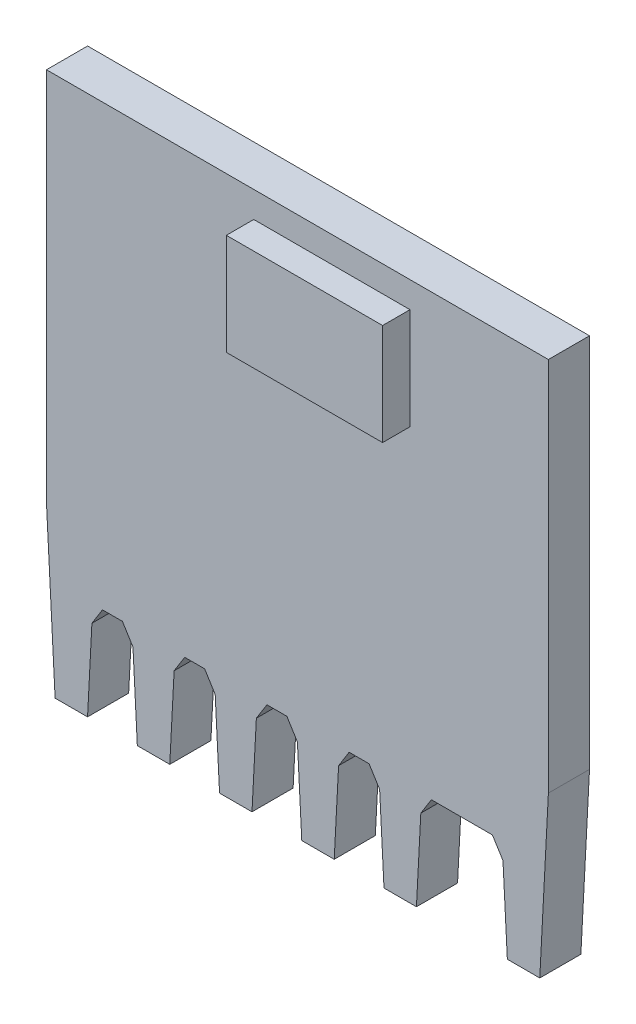
from build123d import *

# Parameters (mm, degrees)
BOSS_EXTRUDE1_DEPTH = 1.5
RGB_LED_W           = 5.7
RGB_LED_H           = 3.7
BOSS_EXTRUDE2_DEPTH = 1


with BuildPart() as part:
    # Sketch1 → Boss-Extrude1 (new body)
    with BuildSketch(Plane.XY):
        Polygon((0, 6), (0.314446676, 0), (1.497941481, 0), (1.657221927, 3.039251967), (2.042586863, 3.65596478), (2.769801294, 3.65596478), (3.155166229, 3.039251967), (3.314446676, 0), (4.497941481, 0), (4.657221927, 3.039251967), (5.042586863, 3.65596478), (5.769801294, 3.65596478), (6.155166229, 3.039251967), (6.314446676, 0), (7.497941481, 0), (7.657221927, 3.039251967), (8.042586863, 3.65596478), (8.769801294, 3.65596478), (9.155166229, 3.039251967), (9.314446676, 0), (10.497941481, 0), (10.657221927, 3.039251967), (11.042586863, 3.65596478), (11.769801294, 3.65596478), (12.155166229, 3.039251967), (12.314446676, 0), (13.497941481, 0), (13.657221927, 3.039251967), (14.042586863, 3.65596478), (16.269801294, 3.65596478), (16.655166229, 3.039251967), (16.814446676, 0), (17.997941481, 0), (18.312388157, 6), (18.312388157, 19.7), (0, 19.7), align=None)
    extrude(amount=BOSS_EXTRUDE1_DEPTH)

    # rgb_led → Boss-Extrude2 (add)
    with BuildSketch(Plane.XY.offset(1.5)):
        with Locations((10.412388157, 16.9)):
            Rectangle(RGB_LED_W, RGB_LED_H)
    extrude(amount=BOSS_EXTRUDE2_DEPTH)


solid = part.part
